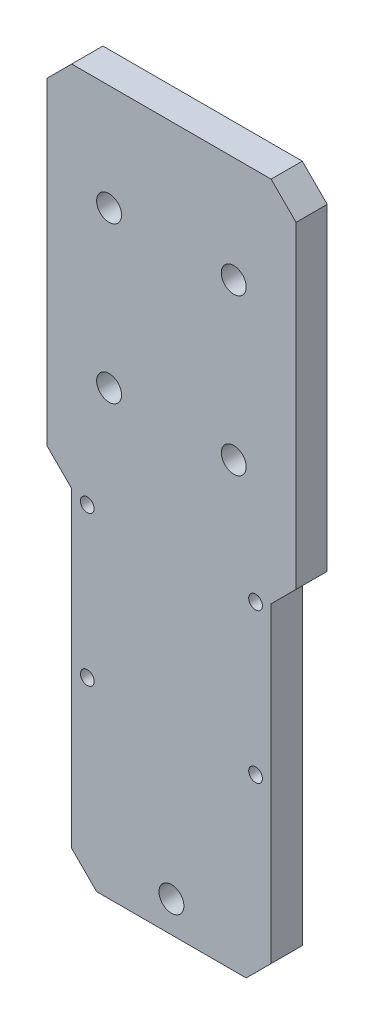
from build123d import *

# Parameters (mm, degrees)
CROQUIS1_R              = 1.1
FORMABASE_DEPTH         = 5
ESQUINAS_DEPTH          = 65.863317831
CROQUIS3_R              = 2
BARRENOSEJEZ_DEPTH      = 65.863317831
SALIENTE_EXTRUIR2_DEPTH = 5
CROQUIS5_R              = 2
CORTAR_EXTRUIR9_DEPTH   = 88.950270039


with BuildPart() as part:
    # Croquis1 → FormaBase (new body)
    with BuildSketch(Plane.XY):
        Polygon((20, 27.5), (-20, 27.5), (-20, -27.5), (-16, -31.5), (-16, -61.5), (16, -61.5), (16, -31.5), (20, -27.5), align=None)
        with Locations((-13.5, -32.5)):
            Circle(CROQUIS1_R, mode=Mode.SUBTRACT)
        with Locations((-13.5, -56.5)):
            Circle(CROQUIS1_R, mode=Mode.SUBTRACT)
        with Locations((13.5, -56.5)):
            Circle(CROQUIS1_R, mode=Mode.SUBTRACT)
        with Locations((13.5, -32.5)):
            Circle(CROQUIS1_R, mode=Mode.SUBTRACT)
    extrude(amount=FORMABASE_DEPTH)

    # Croquis2 → Esquinas (cut, through all)
    with BuildSketch(Plane.XY.offset(5)):
        Polygon((-20, 27.5), (-20, 23.497775618), (-15.997775618, 27.5), align=None)
        Polygon((20, 23.497775618), (15.997775618, 27.5), (20, 27.5), align=None)
    extrude(amount=-ESQUINAS_DEPTH, mode=Mode.SUBTRACT)

    # Croquis3 → BarrenosEjeZ (cut, through all)
    with BuildSketch(Plane.XY.offset(5)):
        with Locations((10.000556095, 10.499443905)):
            Circle(CROQUIS3_R)
        with Locations((10.000556095, -14.500556095)):
            Circle(CROQUIS3_R)
        with Locations(Location((-10.000556095, 10.499443905, 0), (0, 0, 180))):
            Circle(CROQUIS3_R)
        with Locations(Location((-10.000556095, -14.500556095, 0), (0, 0, 180))):
            Circle(CROQUIS3_R)
    extrude(amount=-BARRENOSEJEZ_DEPTH, mode=Mode.SUBTRACT)

    # Croquis4 → Saliente-Extruir2 (add, through all)
    with BuildSketch(Plane.XY.offset(5)):
        Polygon((-16, -61.5), (-16, -81.497775618), (-11.997775618, -85.5), (0, -85.5), (0, -61.5), align=None)
        Polygon((0, -61.5), (0, -85.5), (11.997775618, -85.5), (16, -81.497775618), (16, -61.5), align=None)
    extrude(amount=-SALIENTE_EXTRUIR2_DEPTH)

    # Croquis5 → Cortar-Extruir9 (cut, through all)
    with BuildSketch(Plane.XY.offset(5)):
        with Locations((0, -80.5)):
            Circle(CROQUIS5_R)
    extrude(amount=-CORTAR_EXTRUIR9_DEPTH, mode=Mode.SUBTRACT)


solid = part.part
